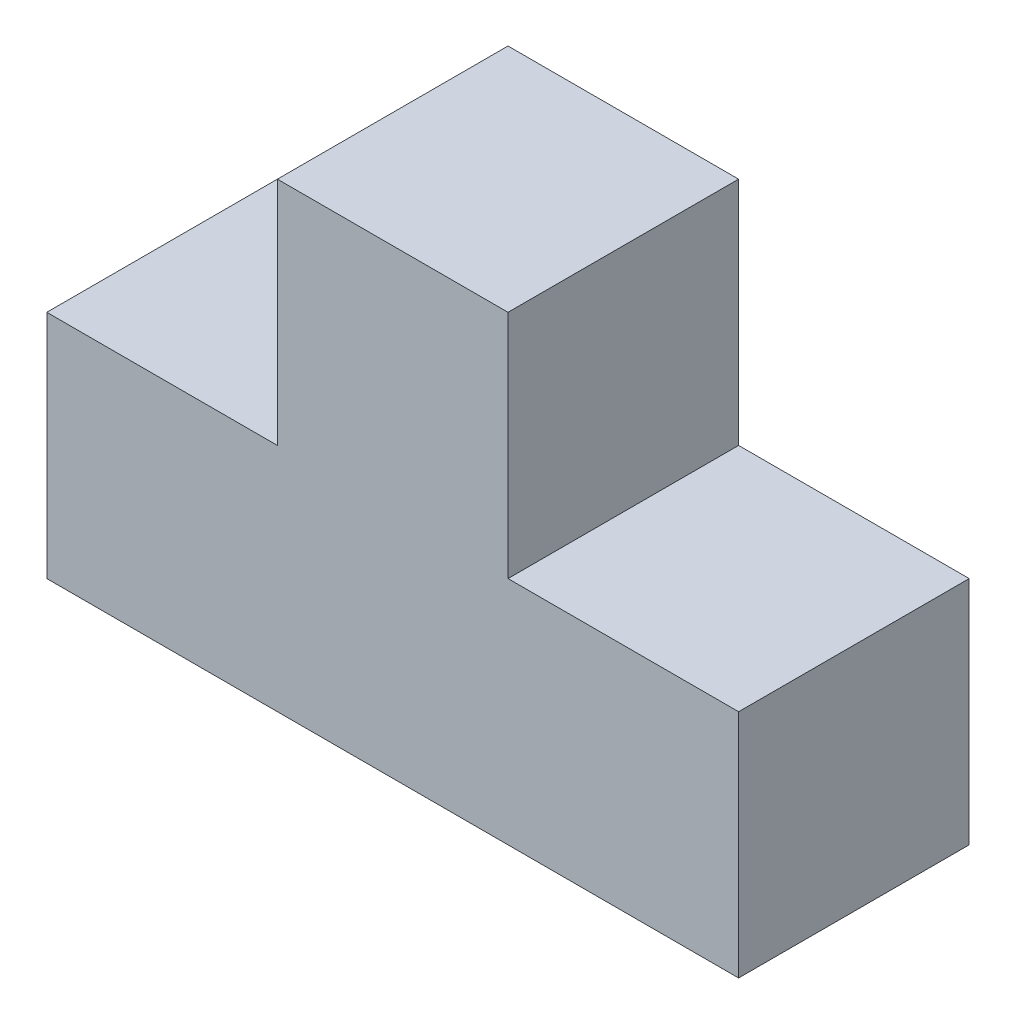
from build123d import *

# Parameters (mm, degrees)
BOSS_EXTRU_1_DEPTH = 300


with BuildPart() as part:
    # Esquisse1 → Boss.-Extru.1 (new body)
    with BuildSketch(Plane.XY):
        Polygon((0, 0), (900, 0), (900, 300), (600, 300), (600, 600), (300, 600), (300, 300), (0, 300), align=None)
    extrude(amount=BOSS_EXTRU_1_DEPTH)


solid = part.part
